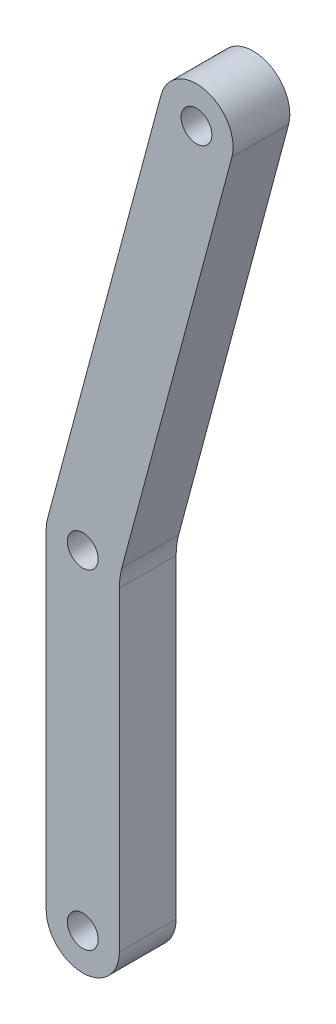
from build123d import *

# Parameters (mm, degrees)
ESQUISSE1_R        = 2.1
BOSS_EXTRU_1_DEPTH = 7.75
CONG_1_R           = 10


with BuildPart() as part:
    # Esquisse1 → Boss.-Extru.1 (new body)
    # profile 1 of 3: a face of its own
    with BuildSketch(Plane.XY):
        with BuildLine():
            Line((10.699513575, 104.249644803), (-4.829629131, 46.294095226))
            ThreePointArc((-4.829629131, 46.294095226), (0.652630961, 49.957224307), (5, 45))
            Line((5, 45), (5, 44.341737512))
            Line((5, 44.341737512), (20.358771838, 101.661454352))
            ThreePointArc((20.358771838, 101.661454352), (16.823237932, 107.785178709), (10.699513575, 104.249644803))
        make_face()
        with Locations((15.529142706, 102.955549577)):
            Circle(ESQUISSE1_R, mode=Mode.SUBTRACT)
    # profile 2 of 3: a face of its own
    with BuildSketch(Plane.XY):
        with BuildLine():
            ThreePointArc((-4.829629131, 46.294095226), (-4.957224307, 45.652630961), (-5, 45))
            ThreePointArc((-5, 45), (-0.652630961, 40.042775693), (4.829629131, 43.705904774))
            Line((4.829629131, 43.705904774), (5, 44.341737512))
            Line((5, 44.341737512), (5, 45))
            ThreePointArc((5, 45), (0.652630961, 49.957224307), (-4.829629131, 46.294095226))
        make_face()
        with Locations((0, 45)):
            Circle(ESQUISSE1_R, mode=Mode.SUBTRACT)
    # profile 3 of 3: a face of its own
    with BuildSketch(Plane.XY):
        with BuildLine():
            Line((-5, 45), (-5, 0))
            ThreePointArc((-5, 0), (0, -5), (5, 0))
            Line((5, 0), (5, 44.341737512))
            Line((5, 44.341737512), (4.829629131, 43.705904774))
            ThreePointArc((4.829629131, 43.705904774), (-0.652630961, 40.042775693), (-5, 45))
        make_face()
        Circle(ESQUISSE1_R, mode=Mode.SUBTRACT)
    extrude(amount=BOSS_EXTRU_1_DEPTH)

    # Congé1
    cong_1_edges = [part.edges().sort_by_distance(p)[0] for p in [
        (5, 44.341737512, 3.875),
    ]]
    fillet(cong_1_edges, radius=CONG_1_R)


solid = part.part
